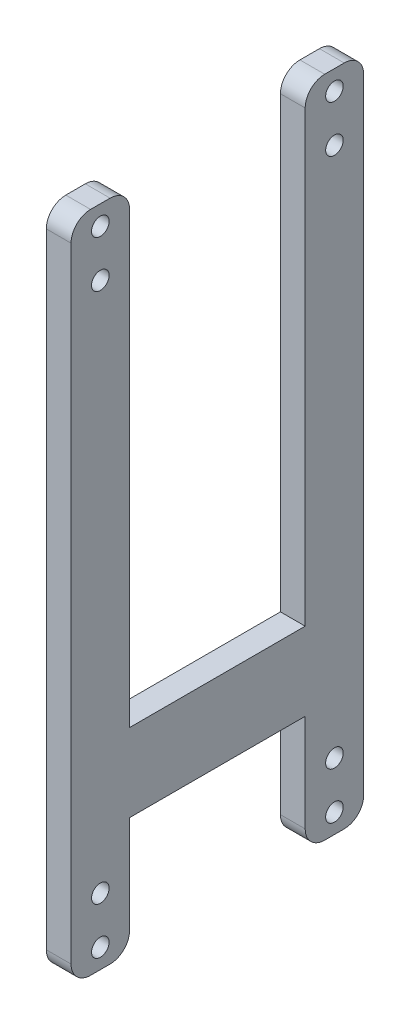
from build123d import *

# Parameters (mm, degrees)
SALIENTE_EXTRUIR1_DEPTH      = 6.35
TALADRO_DE_MARGEN_PARA_M41_D = 4.5
REDONDEO1_R                  = 5


with BuildPart() as part:
    # Croquis1 → Saliente-Extruir1 (new body)
    with BuildSketch(Plane(origin=(0, 0, 0), x_dir=(0, 0, -1), z_dir=(1, 0, 0))):
        Polygon((-22.5, 85), (-22.5, -35), (22.5, -35), (22.5, 85), (37.5, 85), (37.5, 35), (37.5, -35), (37.5, -85), (22.5, -85), (22.5, -55), (-22.5, -55), (-22.5, -85), (-37.5, -85), (-37.5, -35), (-37.5, 35), (-37.5, 85), align=None)
    extrude(amount=SALIENTE_EXTRUIR1_DEPTH)

    # Taladro de margen para M41 (through all)
    with Locations(Plane.ZY):
        with Locations((30, 68), (30, 80), (-30, 68), (-30, 80), (30, -80), (30, -68), (-30, -80), (-30, -68)):
            Hole(TALADRO_DE_MARGEN_PARA_M41_D / 2)

    # Redondeo1
    redondeo1_edges = [part.edges().sort_by_distance(p)[0] for p in [
        (3.175, 85, 22.5),
        (3.175, 85, -22.5),
        (3.175, 85, -37.5),
        (3.175, -85, -37.5),
        (3.175, -85, -22.5),
        (3.175, -85, 22.5),
        (3.175, -85, 37.5),
        (3.175, 85, 37.5),
    ]]
    fillet(redondeo1_edges, radius=REDONDEO1_R)


solid = part.part
